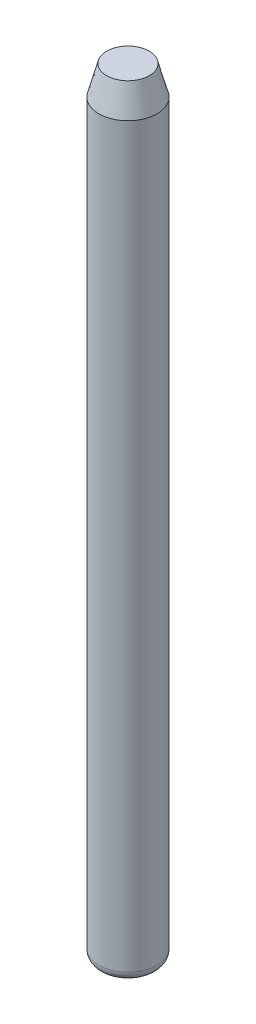
from build123d import *

# Parameters (mm, degrees)
SKETCH1_R           = 1.5
BOSS_EXTRUDE1_DEPTH = 40
CHAMFER1_SIZE       = 1.5
CHAMFER1_SIZE2      = 0.401923789
FILLET1_R           = 0.5


with BuildPart() as part:
    # Sketch1 → Boss-Extrude1 (new body)
    with BuildSketch(Plane(origin=(0, 0, 0), x_dir=(1, 0, 0), z_dir=(0, 1, 0))):
        with Locations(Location((0, 0, 0), (0, 0, 270))):
            Circle(SKETCH1_R)
    extrude(amount=BOSS_EXTRUDE1_DEPTH)

    # Chamfer1
    chamfer1_edges = [part.edges().sort_by_distance(p)[0] for p in [
        (0, 40, -1.5),
    ]]
    chamfer1_side = [part.faces().sort_by_distance(p)[0] for p in [
        (0, 20, -1.5),
    ]]
    chamfer(chamfer1_edges, length=CHAMFER1_SIZE, length2=CHAMFER1_SIZE2, reference=chamfer1_side[0])

    # Fillet1
    fillet1_edges = [part.edges().sort_by_distance(p)[0] for p in [
        (0, 0, -1.5),
    ]]
    fillet(fillet1_edges, radius=FILLET1_R)


solid = part.part
